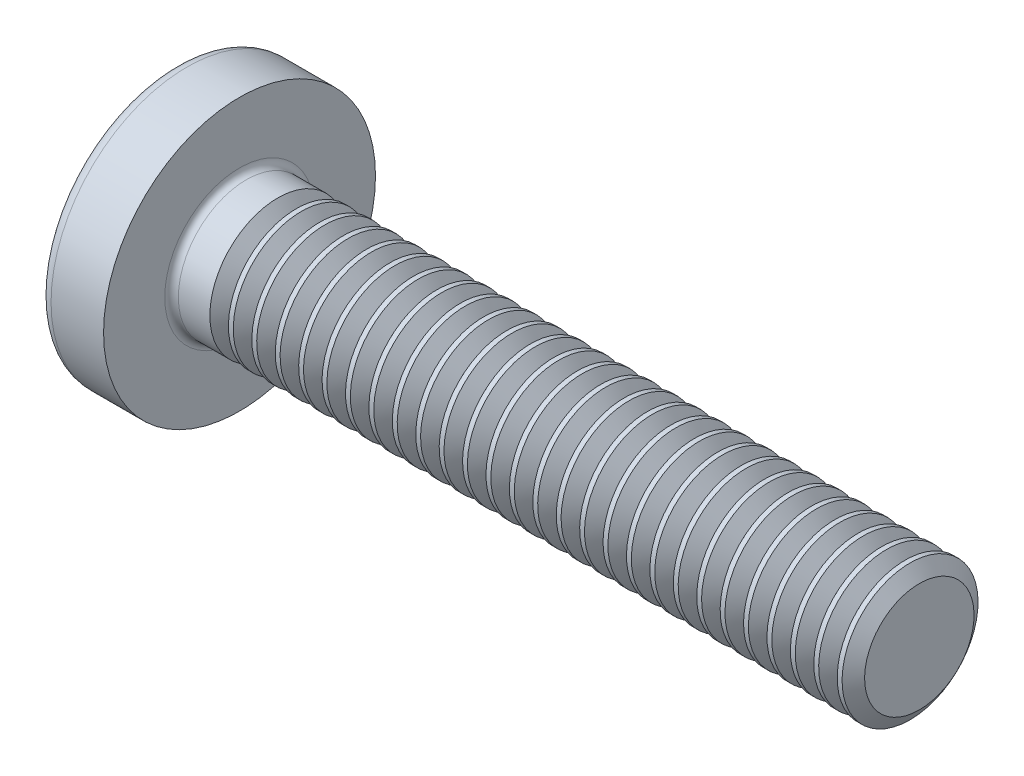
from build123d import *

# Parameters (mm, degrees)
FILLET1_R       = 0.2
RECPAT_COUNT    = 2
RECPAT_ANGLE    = 90
THDSCHPAT_COUNT = 28
THDSCHPAT_PITCH = 0.688888889


with BuildPart() as part:
    # BodySke → Base-Revolve (revolve)
    with BuildSketch(Plane.XY, mode=Mode.PRIVATE) as base_revolve_sk:
        with BuildLine():
            Line((3.1, 2), (3.1, 4))
            Line((3.1, 4), (1.555305874, 4))
            ThreePointArc((1.555305874, 4), (1.392873227, 3.961271902), (1.265388955, 3.853420195))
            ThreePointArc((1.265388955, 3.853420195), (0.324444487, 2.027933456), (0, 0))
            Line((0, 0), (23.1, 0))
            Line((23.1, 0), (23.1, 2))
            Line((23.1, 2), (3.1, 2))
        make_face()
    revolve(base_revolve_sk.sketch.rotate(Axis((1.555305874, 0, 0), (1, 0, 0)), 90), axis=Axis((1.555305874, 0, 0), (1, 0, 0)))

    # Fillet1
    fillet1_edges = [part.edges().sort_by_distance(p)[0] for p in [
        (3.1, 0, -2),
    ]]
    fillet(fillet1_edges, radius=FILLET1_R)

    # Sketch3 → Recess section 0
    with BuildSketch(Plane(origin=(0, 0, 0), x_dir=(0, 0, -1), z_dir=(1, 0, 0))):
        with BuildLine():
            Line((0.515, -2.15), (-0.515, -2.15))
            Line((-0.515, -2.15), (-0.515, 2.15))
            Line((-0.515, 2.15), (0.515, 2.15))
            Line((0.515, 2.15), (0.515, -2.15))
        make_face()
    # Sketch4 → Recess section 1
    with BuildSketch(Plane(origin=(2.34, 0, 0), x_dir=(0, 0, -1), z_dir=(1, 0, 0))):
        with BuildLine():
            Line((0.515, -0.983319232), (-0.515, -0.983319232))
            Line((-0.515, -0.983319232), (-0.515, 0.983319232))
            Line((-0.515, 0.983319232), (0.515, 0.983319232))
            Line((0.515, 0.983319232), (0.515, -0.983319232))
        make_face()
    recess = loft(mode=Mode.SUBTRACT)

    # RecPat: Recess ×2 about axis
    recpat_axis = Axis((0, 0, 0), (1, 0, 0))
    for i in range(1, RECPAT_COUNT):
        add(recess.rotate(recpat_axis, i * RECPAT_ANGLE / (RECPAT_COUNT - 1)), mode=Mode.SUBTRACT)

    # RecCorSke → RecessCore (revolve, cut)
    with BuildSketch(Plane.XY, mode=Mode.PRIVATE) as recesscore_sk:
        Polygon((0, 0), (0, 1.01462874), (2.34, 0.851), (2.616506661, 0), align=None)
    revolve(recesscore_sk.sketch.rotate(Axis((-3.175, 0, 0), (1, 0, 0)), 14.547591759), axis=Axis((-3.175, 0, 0), (1, 0, 0)), mode=Mode.SUBTRACT)

    # ThdSchSke → ThreadSchematic (revolve, cut)
    with BuildSketch(Plane.XY, mode=Mode.PRIVATE) as threadschematic_sk:
        Polygon((4.5, -1.61), (4.22691906, -2), (4.22691906, -2.5), (4.77308094, -2.5), (4.77308094, -2), align=None)
    threadschematic = revolve(threadschematic_sk.sketch.rotate(Axis((-3.175, 0, 0), (1, 0, 0)), 270), axis=Axis((-3.175, 0, 0), (1, 0, 0)), mode=Mode.SUBTRACT)

    # ThdSchPat: ThreadSchematic ×28
    with Locations(*[(i * THDSCHPAT_PITCH, 0, 0) for i in range(1, THDSCHPAT_COUNT)]):
        add(threadschematic, mode=Mode.SUBTRACT)


solid = part.part
